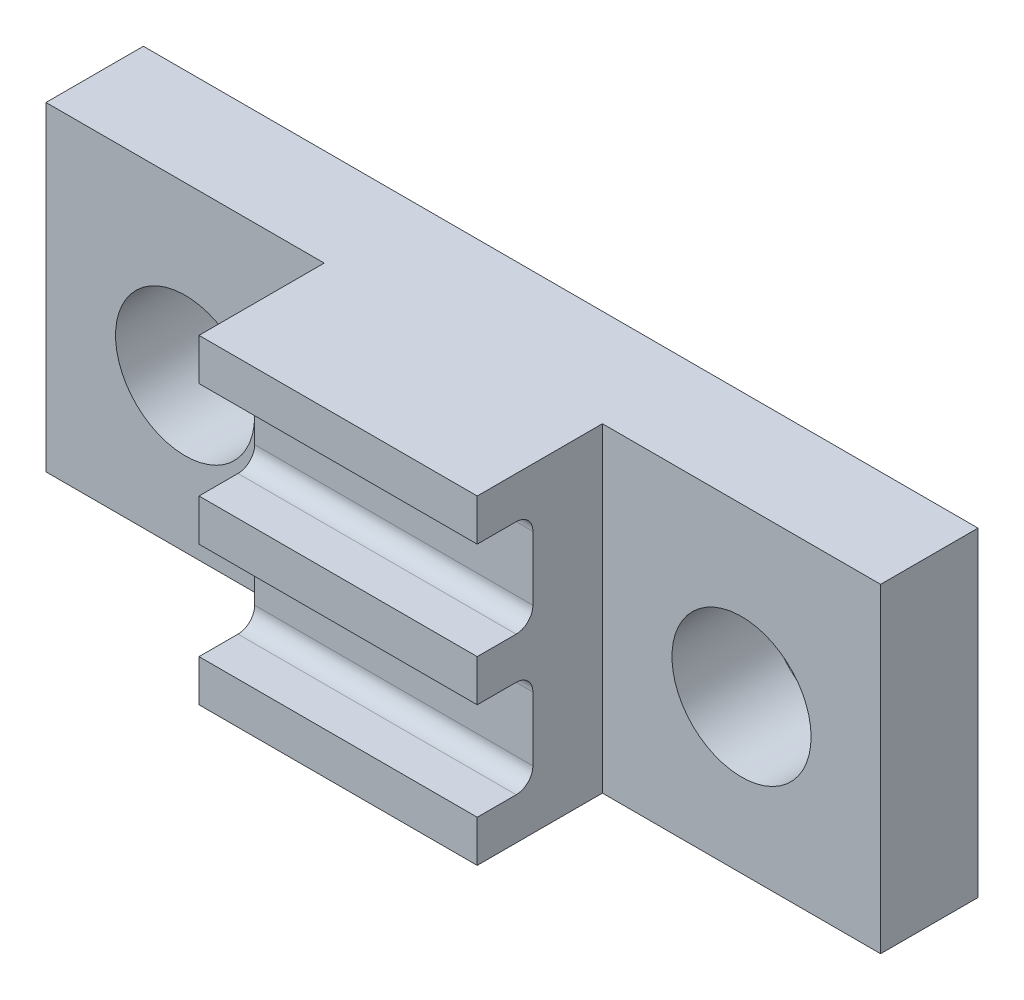
from build123d import *

# Parameters (mm, degrees)
SKETCH1_W              = 30
SKETCH1_H              = 11.5
SKETCH1_R              = 2.5
BOSS_EXTRUDE1_DEPTH    = 3.5
SKETCH2_W              = 10
SKETCH2_H              = 11.5
BOSS_EXTRUDE2_DEPTH    = 4.5
SKETCH3_W              = 2
SKETCH3_H              = 3.5
CUT_EXTRUDE1_DEPTH     = 23.29489852
FILLET1_R              = 0.6
LPATTERN1_COUNT        = 2
LPATTERN1_PITCH        = 5
FILLET1_OF_LPATTERN1_R = 0.6


with BuildPart() as part:
    # Sketch1 → Boss-Extrude1 (new body)
    with BuildSketch(Plane.XY):
        Rectangle(SKETCH1_W, SKETCH1_H)
        with Locations((-10, -0.25)):
            Circle(SKETCH1_R, mode=Mode.SUBTRACT)
        with Locations((10, -0.25)):
            Circle(SKETCH1_R, mode=Mode.SUBTRACT)
    extrude(amount=BOSS_EXTRUDE1_DEPTH)

    # Sketch2 → Boss-Extrude2 (add)
    with BuildSketch(Plane.XY.offset(3.5)):
        Rectangle(SKETCH2_W, SKETCH2_H)
    extrude(amount=BOSS_EXTRUDE2_DEPTH)

    # Sketch3 → Cut-Extrude1 (cut, through all)
    with BuildSketch(Plane.ZY.offset(5)):
        with Locations((7, 2.5)):
            Rectangle(SKETCH3_W, SKETCH3_H)
    cut_extrude1 = extrude(amount=-CUT_EXTRUDE1_DEPTH, mode=Mode.SUBTRACT)

    # Fillet1
    fillet1_edges = [part.edges().sort_by_distance(p)[0] for p in [
        (0, 0.75, 6),
        (0, 4.25, 6),
    ]]
    fillet(fillet1_edges, radius=FILLET1_R)

    # LPattern1: Cut-Extrude1 ×2
    with Locations(*[(0, -i * LPATTERN1_PITCH, 0) for i in range(1, LPATTERN1_COUNT)]):
        add(cut_extrude1, mode=Mode.SUBTRACT)

    # Fillet1 of LPattern1
    fillet1_of_lpattern1_edges = [part.edges().sort_by_distance(p)[0] for p in [
        (0, -4.25, 6),
        (0, -0.75, 6),
    ]]
    fillet(fillet1_of_lpattern1_edges, radius=FILLET1_OF_LPATTERN1_R)


solid = part.part
